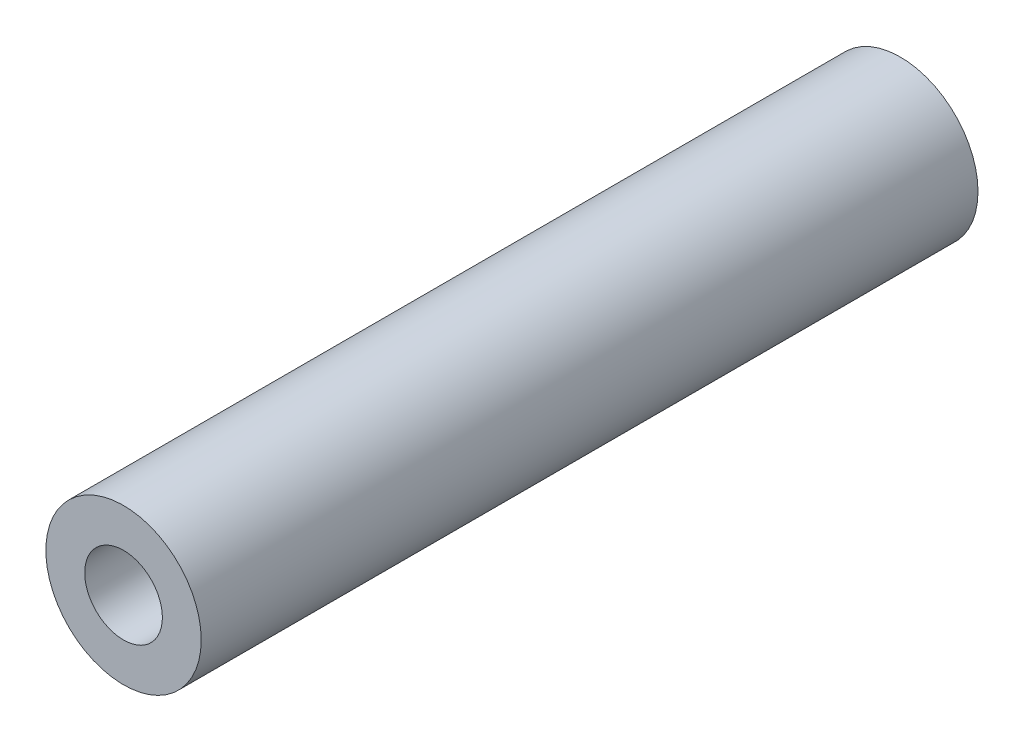
from build123d import *

# Parameters (mm, degrees)
SKETCH1_R           = 5
BOSS_EXTRUDE1_DEPTH = 50
SKETCH2_R           = 2.5
CUT_EXTRUDE1_DEPTH  = 8
CUT_EXTRUDE2_START  = -8
SKETCH3_R           = 2.5
CUT_EXTRUDE2_DEPTH  = 8


with BuildPart() as part:
    # Sketch1 → Boss-Extrude1 (new body)
    with BuildSketch(Plane.XY):
        Circle(SKETCH1_R)
    extrude(amount=BOSS_EXTRUDE1_DEPTH)

    # Sketch2 → Cut-Extrude1 (cut)
    with BuildSketch(Plane(origin=(0, 0, 0), x_dir=(-1, 0, 0), z_dir=(0, 0, -1))):
        Circle(SKETCH2_R)
    extrude(amount=-CUT_EXTRUDE1_DEPTH, mode=Mode.SUBTRACT)

    # Sketch3 → Cut-Extrude2 (cut)
    with BuildSketch(Plane.XY.offset(50).offset(CUT_EXTRUDE2_START)):
        with Locations(Location((0, 0, 0), (0, 0, 180))):
            Circle(SKETCH3_R)
    extrude(amount=CUT_EXTRUDE2_DEPTH, mode=Mode.SUBTRACT)


solid = part.part
